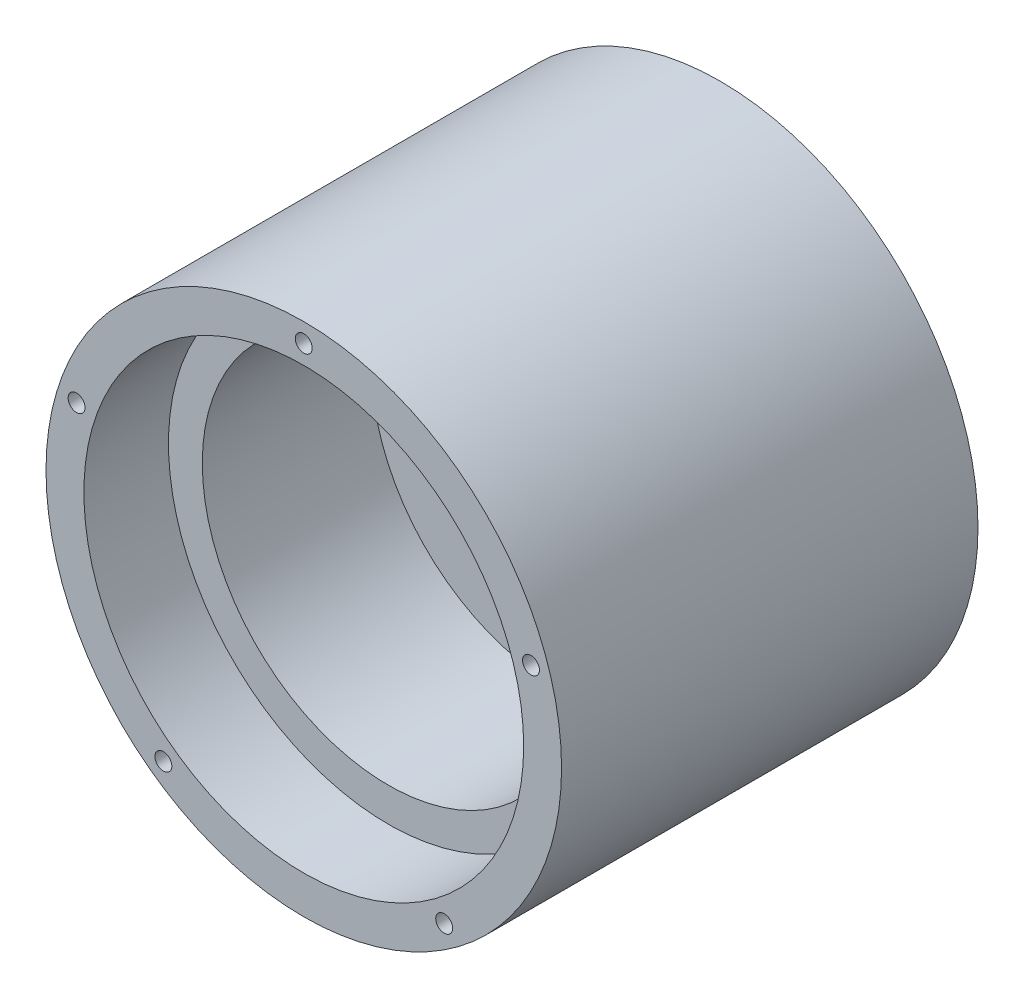
from build123d import *

# Parameters (mm, degrees)
SKETCH2_R           = 76.2
BOSS_EXTRUDE1_DEPTH = 85
SKETCH4_R           = 65
CUT_EXTRUDE2_DEPTH  = 25
SKETCH5_R           = 55
CUT_EXTRUDE3_DEPTH  = 50
SKETCH7_R           = 2.5
CUT_EXTRUDE4_DEPTH  = 20
CIRPATTERN1_COUNT   = 5
BOSS_EXTRUDE2_START = 38.1
SKETCH8_R           = 76.2
SKETCH8_R_2         = 50.8
BOSS_EXTRUDE2_DEPTH = 38.1


with BuildPart() as part:
    # Sketch2 → Boss-Extrude1 (new body)
    with BuildSketch(Plane(origin=(0, 0, 0), x_dir=(0, 1, 0), z_dir=(0, 0, 1))):
        with Locations(Location((0, 0, 0), (0, 0, 270))):
            Circle(SKETCH2_R)
    extrude(amount=BOSS_EXTRUDE1_DEPTH)

    # Sketch4 → Cut-Extrude2 (cut)
    with BuildSketch(Plane.XY.offset(85)):
        Circle(SKETCH4_R)
    extrude(amount=-CUT_EXTRUDE2_DEPTH, mode=Mode.SUBTRACT)

    # Sketch5 → Cut-Extrude3 (cut)
    with BuildSketch(Plane.XY.offset(60)):
        Circle(SKETCH5_R)
    extrude(amount=-CUT_EXTRUDE3_DEPTH, mode=Mode.SUBTRACT)

    # Sketch7 → Cut-Extrude4 (cut)
    with BuildSketch(Plane.XY.offset(85)):
        with Locations((0, 70.612)):
            Circle(SKETCH7_R)
    cut_extrude4 = extrude(amount=-CUT_EXTRUDE4_DEPTH, mode=Mode.SUBTRACT)

    # CirPattern1: Cut-Extrude4 ×5 about axis
    cirpattern1_axis = Axis((0, 0, 0), (0, 0, 1))
    for i in range(1, CIRPATTERN1_COUNT):
        add(cut_extrude4.rotate(cirpattern1_axis, i * 360 / CIRPATTERN1_COUNT), mode=Mode.SUBTRACT)

    # Sketch8 → Boss-Extrude2 (add)
    with BuildSketch(Plane(origin=(0, 0, 0), x_dir=(1, 0, 0), z_dir=(0, 0, -1)).offset(BOSS_EXTRUDE2_START)):
        with Locations(Location((0, 0, 0), (0, 0, 180))):
            Circle(SKETCH8_R)
        Circle(SKETCH8_R_2, mode=Mode.SUBTRACT)
    extrude(amount=-BOSS_EXTRUDE2_DEPTH)

    # Sketch10 → Cut-Revolve1 (revolve, cut)
    with BuildSketch(Plane.YZ, mode=Mode.PRIVATE) as cut_revolve1_sk:
        Polygon((0, 10.519966747), (-25.372140722, 10), (-25.372140722, 0), (-63.592993734, 0), (-63.592993734, -38.1), (0, -38.1), align=None)
    revolve(cut_revolve1_sk.sketch.rotate(Axis((0, 0, -38.1), (0, 0, 1)), 270), axis=Axis((0, 0, -38.1), (0, 0, 1)), mode=Mode.SUBTRACT)


solid = part.part
